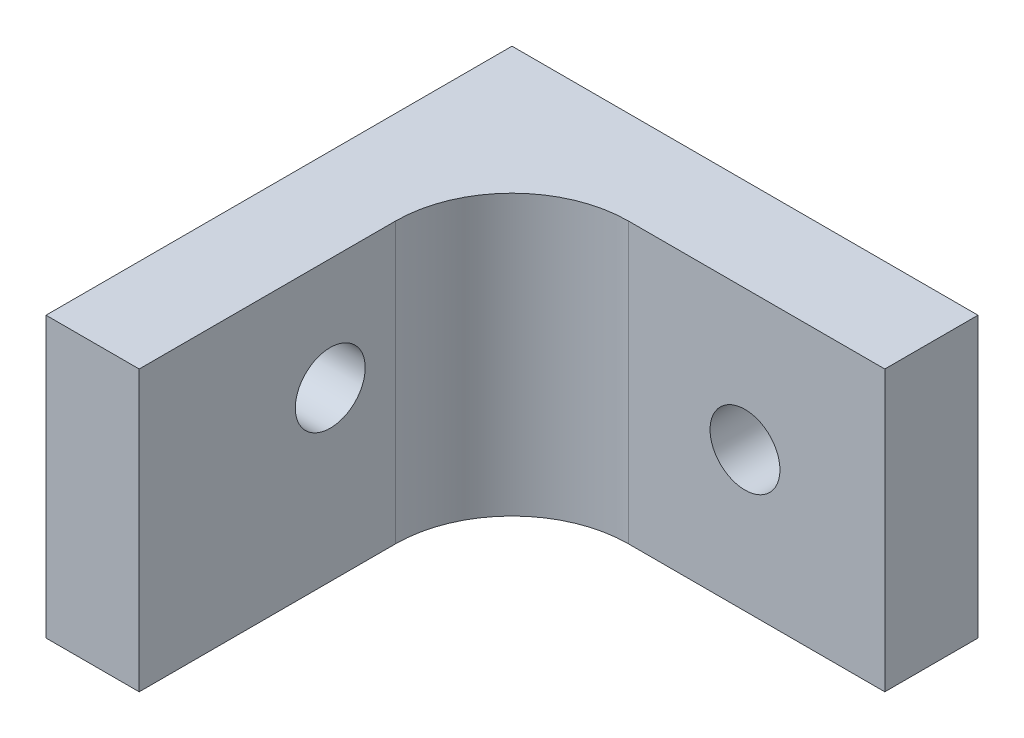
from build123d import *

# Parameters (mm, degrees)
SKETCH1_W           = 10
SKETCH1_H           = 6
SKETCH1_R           = 0.75
BOSS_EXTRUDE1_DEPTH = 2
SKETCH2_W           = 10
SKETCH2_H           = 6
SKETCH2_R           = 0.75
BOSS_EXTRUDE2_DEPTH = 2
FILLET2_R           = 2.5


with BuildPart() as part:
    # Sketch1 → Boss-Extrude1 (new body)
    with BuildSketch(Plane.XY):
        with Locations((-5, -3)):
            Rectangle(SKETCH1_W, SKETCH1_H)
        with Locations((-3, -3)):
            Circle(SKETCH1_R, mode=Mode.SUBTRACT)
    extrude(amount=BOSS_EXTRUDE1_DEPTH)

    # Sketch2 → Boss-Extrude2 (add)
    with BuildSketch(Plane.ZY.offset(10)):
        with Locations((5, -3)):
            Rectangle(SKETCH2_W, SKETCH2_H)
        with Locations((5.9, -2.4)):
            Circle(SKETCH2_R, mode=Mode.SUBTRACT)
    extrude(amount=-BOSS_EXTRUDE2_DEPTH)

    # Fillet2
    fillet2_edges = [part.edges().sort_by_distance(p)[0] for p in [
        (-8, -3, 2),
    ]]
    fillet(fillet2_edges, radius=FILLET2_R)


solid = part.part
